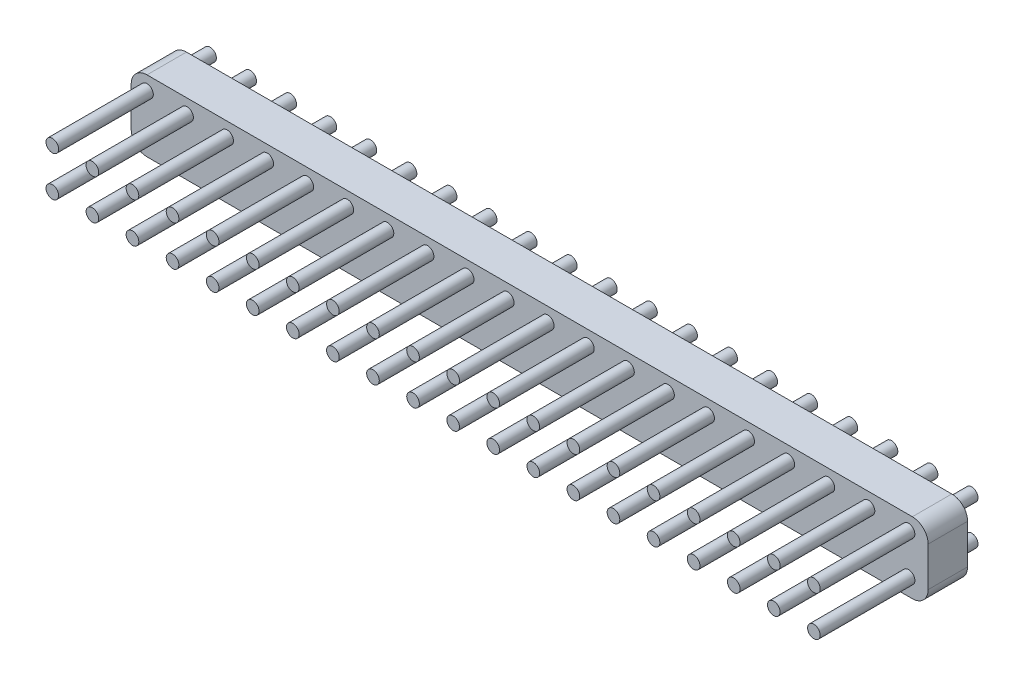
from build123d import *

# Parameters (mm, degrees)
SKETCH_1_W             = 50.5
SKETCH_1_H             = 4.5
EXTRUDE_1_DEPTH        = 2.5
EXTRUDE_START          = -4
SKETCH_2_R             = 0.4
EXTRUDE_2_DEPTH        = 10
PATTERN_LINEAR_2_COUNT = 20
PATTERN_LINEAR_2_PITCH = 2.54
FILLET_1_R             = 1


with BuildPart() as part:
    # ｽｹｯﾁ1 → ﾎﾞｽ - 押し出し1 (new body)
    with BuildSketch(Plane.XY):
        Rectangle(SKETCH_1_W, SKETCH_1_H)
    extrude(amount=EXTRUDE_1_DEPTH)

    # ｽｹｯﾁ2 → ﾎﾞｽ - 押し出し2 (add)
    with BuildSketch(Plane.XY.offset(2.5).offset(EXTRUDE_START)):
        with Locations((-24.25, 1.37)):
            Circle(SKETCH_2_R)
        with Locations((-24.25, -1.17)):
            Circle(SKETCH_2_R)
    extrude_2 = extrude(amount=EXTRUDE_2_DEPTH)

    # 直線ﾊﾟﾀｰﾝ2: ﾎﾞｽ - 押し出し2 ×20
    with Locations(*[(i * PATTERN_LINEAR_2_PITCH, 0, 0) for i in range(1, PATTERN_LINEAR_2_COUNT)]):
        add(extrude_2)

    # ﾌｨﾚｯﾄ1
    fillet_1_edges = [part.edges().sort_by_distance(p)[0] for p in [
        (25.25, -2.25, 1.25),
        (-25.25, -2.25, 1.25),
        (-25.25, 2.25, 1.25),
        (25.25, 2.25, 1.25),
    ]]
    fillet(fillet_1_edges, radius=FILLET_1_R)


solid = part.part
